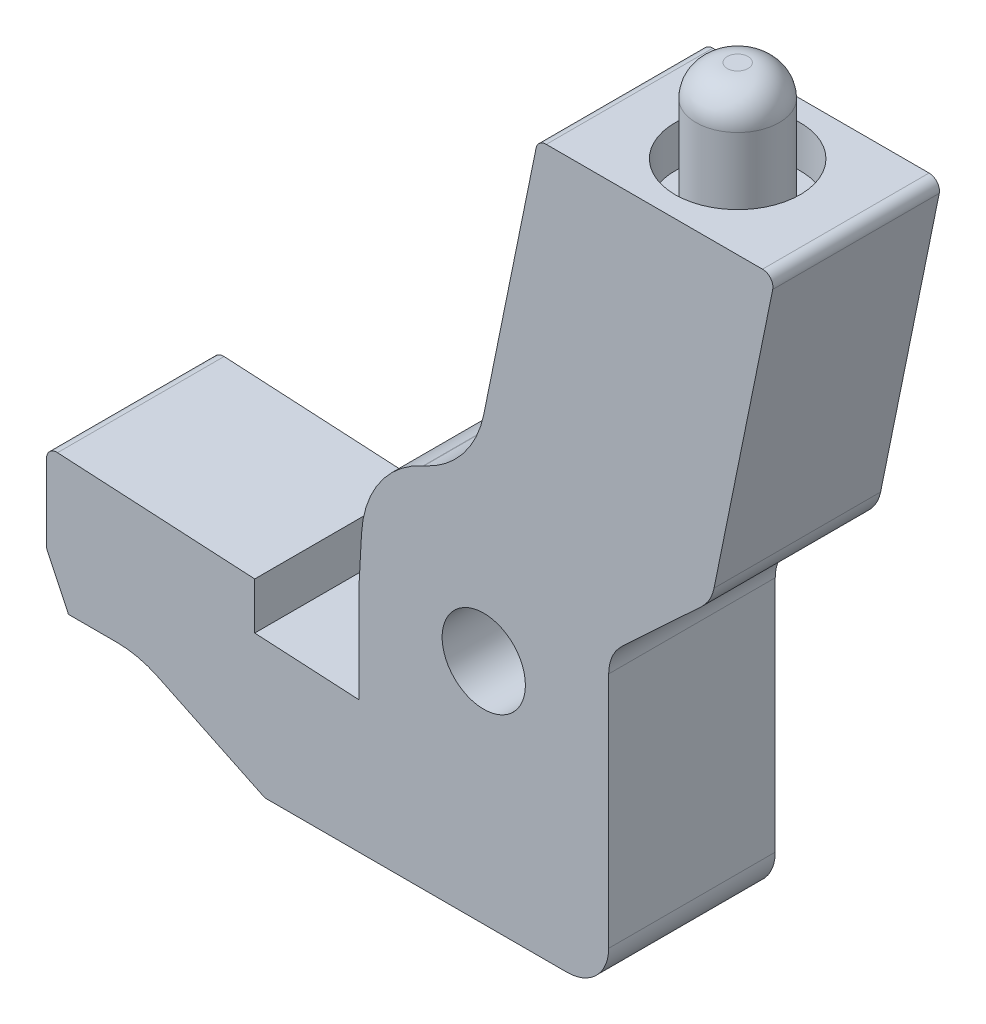
from build123d import *

# Parameters (mm, degrees)
SKETCH_1_R          = 2
EXTRUDE_1_DEPTH     = 8
SKETCH_4_R          = 3
SKETCH_4_R_2        = 2
CUT_EXTRUDE_1_DEPTH = 2
EXTRUDE_START       = 4
SKETCH_4_3_R        = 2
EXTRUDE_2_DEPTH     = 4
FILLET_1_R          = 1.5


with BuildPart() as part:
    # 스케치1 → 보스-돌출1 (new body)
    with BuildSketch(Plane.XY):
        with BuildLine():
            Line((6, -8.942177653), (6, 0))
            Line((6, 0), (6, 2.471508524))
            ThreePointArc((6, 2.471508524), (6.165879851, 3.269006662), (6.63600328, 3.934215927))
            Line((6.63600328, 3.934215927), (10.465403959, 7.505189831))
            ThreePointArc((10.465403959, 7.505189831), (10.846309641, 7.990494755), (11.061183494, 8.568801969))
            Line((11.061183494, 8.568801969), (13.877860093, 22.400226184))
            ThreePointArc((13.877860093, 22.400226184), (13.775141356, 22.81631716), (13.387916029, 23))
            Line((13.387916029, 23), (3.002563604, 23))
            ThreePointArc((3.002563604, 23), (2.686246444, 22.887225327), (2.51261954, 22.599773816))
            Line((2.51261954, 22.599773816), (0, 10.261436228))
            ThreePointArc((0, 10.261436228), (-1.001221601, 8.128058241), (-2.868431988, 6.690257248))
            Line((-2.868431988, 6.690257248), (-2.909187531, 6.672140294))
            ThreePointArc((-2.909187531, 6.672140294), (-4.995156756, 4.940562252), (-5.870795397, 2.374848493))
            Line((-5.870795397, 2.374848493), (-5.964585443, 0.650938163))
            Line((-5.964585443, 0.650938163), (-6, 0))
            Line((-6, 0), (-6, -4.601356756))
            Line((-6, -4.601356756), (-11, -4.329329712))
            Line((-11, -4.329329712), (-11, -2.078450028))
            Line((-11, -2.078450028), (-20.472837466, -1.563076433))
            ThreePointArc((-20.472837466, -1.563076433), (-20.84381589, -1.699308287), (-21, -2.062338084))
            Line((-21, -2.062338084), (-21, -5.795614421))
            Line((-21, -5.795614421), (-19.946933303, -8.027214437))
            Line((-19.946933303, -8.027214437), (-17.618068878, -8.027214437))
            ThreePointArc((-17.618068878, -8.027214437), (-16.616104954, -8.139678872), (-15.664006617, -8.471475061))
            Line((-15.664006617, -8.471475061), (-10.511224254, -10.942177653))
            Line((-10.511224254, -10.942177653), (4, -10.942177653))
            ThreePointArc((4, -10.942177653), (5.414213562, -10.356391215), (6, -8.942177653))
        make_face()
        Circle(SKETCH_1_R, mode=Mode.SUBTRACT)
    extrude(amount=EXTRUDE_1_DEPTH)

    # 스케치4 → 컷-돌출1 (cut)
    with BuildSketch(Plane(origin=(0, 23, 0), x_dir=(1, 0, 0), z_dir=(0, 1, 0))):
        with Locations((8.195239817, -4)):
            Circle(SKETCH_4_R)
        with Locations((8.195239817, -4)):
            Circle(SKETCH_4_R_2, mode=Mode.SUBTRACT)
    extrude(amount=-CUT_EXTRUDE_1_DEPTH, mode=Mode.SUBTRACT)

    # 스케치4<3> → 보스-돌출2 (add)
    with BuildSketch(Plane(origin=(0, 23, 0), x_dir=(1, 0, 0), z_dir=(0, 1, 0)).offset(EXTRUDE_START)):
        with Locations((8.195239817, -4)):
            Circle(SKETCH_4_3_R)
    extrude(amount=-EXTRUDE_2_DEPTH)

    # 필렛1
    fillet_1_edges = [part.edges().sort_by_distance(p)[0] for p in [
        (6.195239817, 27, 4),
    ]]
    fillet(fillet_1_edges, radius=FILLET_1_R)


solid = part.part
